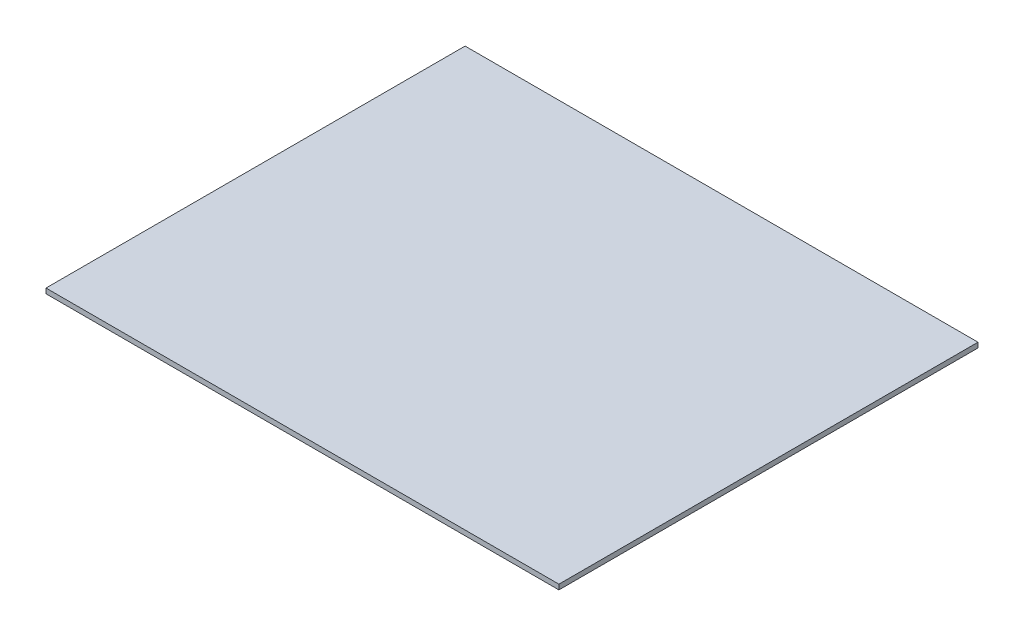
from build123d import *

# Parameters (mm, degrees)
SKETCH1_W           = 410
SKETCH1_H           = 335
BOSS_EXTRUDE1_DEPTH = 4


with BuildPart() as part:
    # Sketch1 → Boss-Extrude1 (new body)
    with BuildSketch(Plane(origin=(0, 0, 0), x_dir=(1, 0, 0), z_dir=(0, 1, 0))):
        Rectangle(SKETCH1_W, SKETCH1_H)
    extrude(amount=BOSS_EXTRUDE1_DEPTH)


solid = part.part
